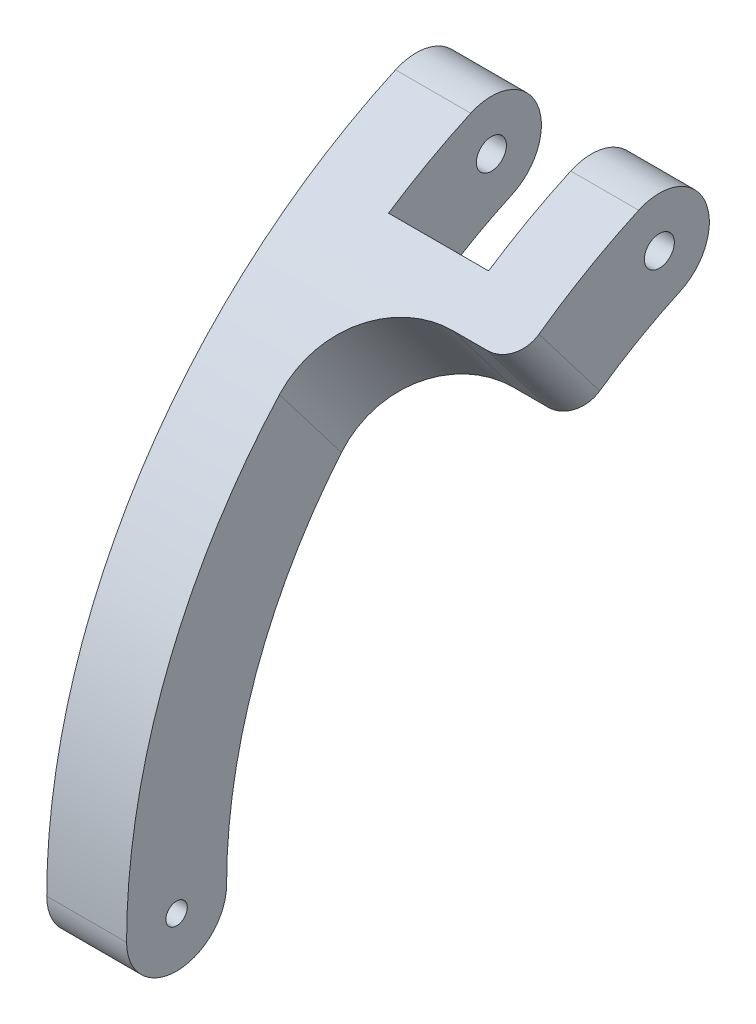
from build123d import *

# Parameters (mm, degrees)
ESQUISSE1_R                  = 0.7499999999999986
ESQUISSE1_R_2                = 1.050000000000001
BOSS_EXTRU_1_DEPTH           = 5.588
BOSS_EXTRU_2_DEPTH           = 11.43
ENL_V_MAT_EXTRU_1_DEPTH      = 3.5
ENL_V_MAT_EXTRU_1_DEPTH_BACK = 3.5
CONG_1_R                     = 7
CONG_2_R                     = 2
ESQUISSE5_R                  = 1.0500000000000025
ENL_V_MAT_EXTRU_2_DEPTH      = 59.98362409134528


with BuildPart() as part:
    # Esquisse1 → Boss.-Extru.1 (new body)
    with BuildSketch(Plane(origin=(0, 0, 0), x_dir=(0, 0, -1), z_dir=(1, 0, 0))):
        with BuildLine():
            ThreePointArc((-34.6, 0), (-29.084530777641156, 18.741666666666667), (-14.296527777777778, 31.508241675777914))
            ThreePointArc((-14.296527777777778, 31.508241675777914), (-12.55545845283557, 36.141672111831234), (-17.18888888888889, 37.88274143677345))
            ThreePointArc((-17.18888888888889, 37.88274143677345), (-34.968684403175494, 22.53333333333333), (-41.6, 0))
            ThreePointArc((-41.6, 0), (-38.1, -3.5), (-34.6, 0))
        make_face()
        with Locations((-38.1, 0)):
            Circle(ESQUISSE1_R, mode=Mode.SUBTRACT)
        with Locations((-15.742708333333335, 34.69549155627568)):
            Circle(ESQUISSE1_R_2, mode=Mode.SUBTRACT)
    extrude(amount=BOSS_EXTRU_1_DEPTH)

    # Esquisse2 → Boss.-Extru.2 (add)
    with BuildSketch(Plane(origin=(5.588, 0, 0), x_dir=(0, 0, -1), z_dir=(1, 0, 0))):
        with BuildLine():
            Line((-21.515108455003254, 27.09723432694649), (-25.765862615540357, 32.66007231585839))
            ThreePointArc((-25.765862615540357, 32.66007231585839), (-21.63554338093815, 35.53115903839253), (-17.188888888888894, 37.88274143677345))
            ThreePointArc((-17.188888888888894, 37.88274143677345), (-12.555458452835564, 36.141672111831234), (-14.296527777777776, 31.508241675777906))
            ThreePointArc((-14.296527777777776, 31.508241675777906), (-18.04113546523944, 29.52418383503393), (-21.515108455003254, 27.09723432694649))
        make_face()
    extrude(amount=BOSS_EXTRU_2_DEPTH)

    # Esquisse4 → Enlèv. mat.-Extru.1 (cut, two sides: drawn at the far end of the back side and taken through both)
    with BuildSketch(Plane(origin=(8.762999999999998, 0, 0), x_dir=(0, 0, -1), z_dir=(1, 0, 0)).offset(-ENL_V_MAT_EXTRU_1_DEPTH_BACK)):
        with BuildLine():
            Line((-22.940194161396708, 34.703133746643395), (-19.080065336161688, 28.86366412581397))
            ThreePointArc((-19.080065336161688, 28.86366412581397), (-16.740600036372985, 30.28055994234895), (-14.296527777777776, 31.508241675777906))
            ThreePointArc((-14.296527777777776, 31.508241675777906), (-12.555458452835564, 36.141672111831234), (-17.188888888888894, 37.88274143677345))
            ThreePointArc((-17.188888888888894, 37.88274143677345), (-20.127426633327065, 36.40668478617679), (-22.940194161396708, 34.703133746643395))
        make_face()
    extrude(amount=ENL_V_MAT_EXTRU_1_DEPTH + ENL_V_MAT_EXTRU_1_DEPTH_BACK, mode=Mode.SUBTRACT)

    # Congé1
    cong_1_edges = [part.edges().sort_by_distance(p)[0] for p in [
        (5.588, 29.878653321402442, 23.640485535271807),
    ]]
    fillet(cong_1_edges, radius=CONG_1_R)

    # Congé2
    cong_2_edges = [part.edges().sort_by_distance(p)[0] for p in [
        (17.018, 29.878653321402442, 23.640485535271807),
    ]]
    fillet(cong_2_edges, radius=CONG_2_R)

    # Esquisse5 → Enlèv. mat.-Extru.2 (cut, through all)
    with BuildSketch(Plane.ZY):
        with Locations(Location((15.742708333333335, 34.69549155627568, 0), (0, 0, 180))):
            Circle(ESQUISSE5_R)
    extrude(amount=-ENL_V_MAT_EXTRU_2_DEPTH, mode=Mode.SUBTRACT)


solid = part.part
